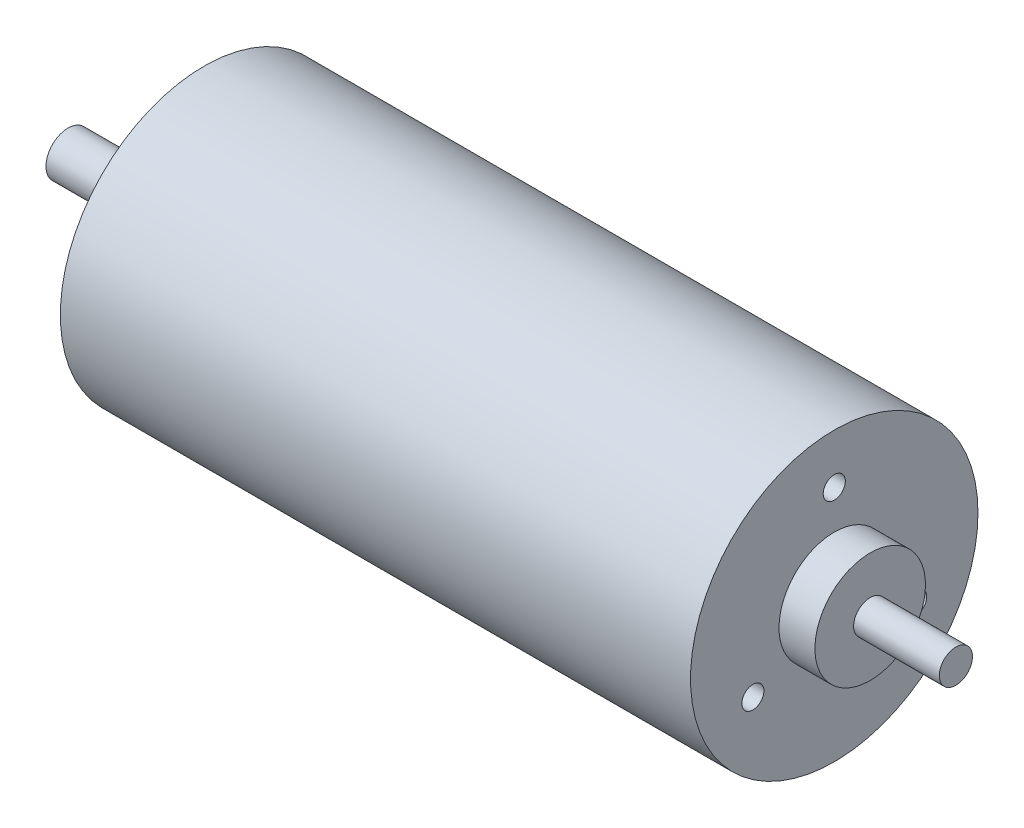
from build123d import *

# Parameters (mm, degrees)
SZKIC2_R                   = 1
WYTNIJ_WYCI_GNI_CIE1_DEPTH = 2.9


with BuildPart() as part:
    # Szkic1 → Obrót1 (revolve)
    with BuildSketch(Plane.XY, mode=Mode.PRIVATE) as obr_t1_sk:
        Polygon((0, 0), (0, 2), (11.2, 2), (11.2, 5), (12.3, 5), (12.3, 13), (69.3, 13), (69.3, 5), (72.55, 5), (72.55, 1.5), (80.3, 1.5), (80.3, 0), align=None)
    revolve(obr_t1_sk.sketch.rotate(Axis((0, 0, 0), (-1, 0, 0)), 90), axis=Axis((0, 0, 0), (-1, 0, 0)))

    # Szkic2 → Wytnij-wyciągnięcie1 (cut)
    with BuildSketch(Plane(origin=(69.3, 0, 0), x_dir=(0, 0, -1), z_dir=(1, 0, 0))):
        with Locations((0, 8.5)):
            Circle(SZKIC2_R)
        with Locations((7.361215932, -4.25)):
            Circle(SZKIC2_R)
        with Locations((-7.361215932, -4.25)):
            Circle(SZKIC2_R)
    extrude(amount=-WYTNIJ_WYCI_GNI_CIE1_DEPTH, mode=Mode.SUBTRACT)


solid = part.part
